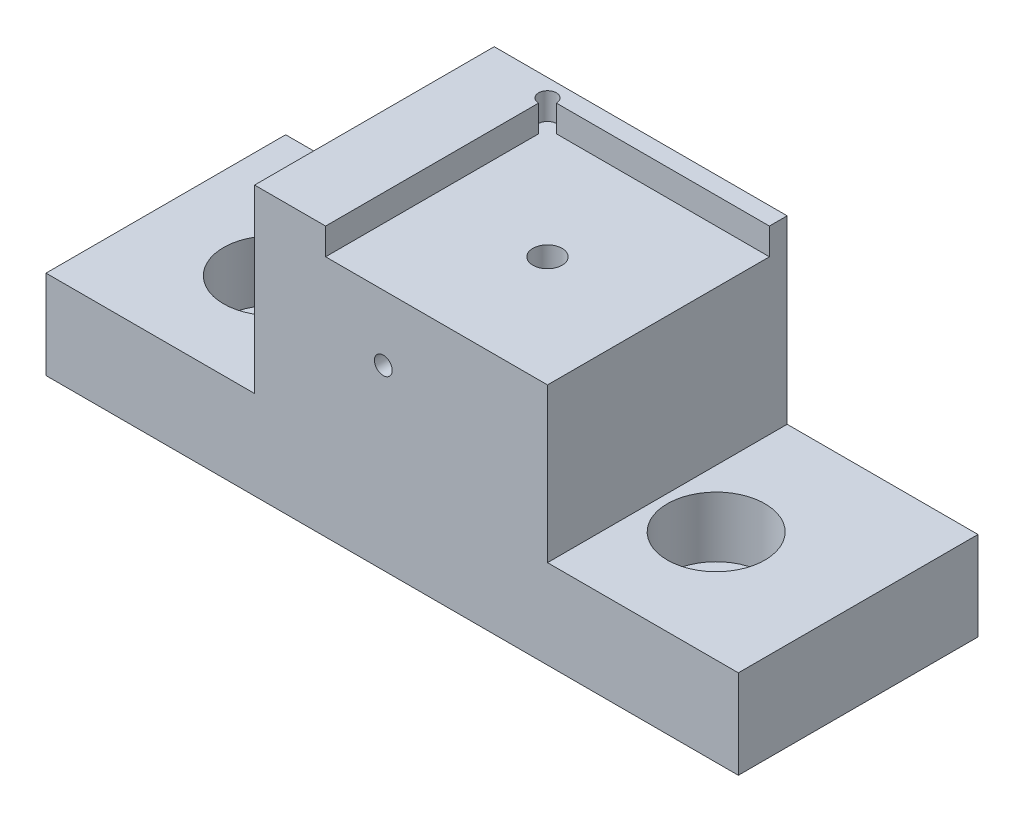
from build123d import *

# Parameters (mm, degrees)
SKETCH_1_W                = 29
SKETCH_1_H                = 29
EXTRUDE_1_DEPTH           = 5
SKETCH_2_W                = 25
SKETCH_2_H                = 25
CUT_EXTRUDE_1_DEPTH       = 3
SKETCH_3_W                = 35
SKETCH_3_H                = 29
EXTRUDE_748_DEPTH         = 25.341167732
HOLE_WIZARD_M4_1_D        = 3.3
HOLE_WIZARD_M4_1_DEPTH    = 10.1
HOLE_WIZARD_M4_1_TIP      = 0.991420021
SKETCH_9_R                = 1
CUT_EXTRUDE_2_DEPTH       = 3
SKETCH_11_W               = 29
SKETCH_11_H               = 5
EXTRUDE_4_DEPTH           = 6
CUT_EXTRUDE_8_DEPTH       = 40.383835
SKETCH_19_W               = 80
SKETCH_19_H               = 25
EXTRUDE_5_DEPTH           = 10
HOLE_WIZARD_1_D           = 6.6
HOLE_WIZARD_1_DEPTH       = 10.1
HOLE_WIZARD_1_CBORE_D     = 11
HOLE_WIZARD_1_CBORE_DEPTH = 6.8
HOLE_WIZARD_1_TIP         = 1.982840043
SKETCH_23_W               = 80
SKETCH_23_H               = 10
EXTRUDE_6_DEPTH           = 2
SKETCH_24_W               = 27
SKETCH_24_H               = 10
CUT_EXTRUDE_9_DEPTH       = 2
MM_1_D                    = 4
MM_1_DEPTH                = 5
MM_1_TIP                  = 1.201721238
CUT_EXTRUDE_10_DEPTH      = 5
SKETCH_28_R               = 1
CUT_EXTRUDE_11_DEPTH      = 2
HOLE_WIZARD_M6_1_D        = 5
HOLE_WIZARD_M6_1_DEPTH    = 10
HOLE_WIZARD_M6_1_TIP      = 1.502151548


with BuildPart() as part:
    # 草图1 → 凸台-拉伸1 (new body)
    with BuildSketch(Plane(origin=(0, 0, 0), x_dir=(1, 0, 0), z_dir=(0, 1, 0))):
        Rectangle(SKETCH_1_W, SKETCH_1_H)
    extrude(amount=EXTRUDE_1_DEPTH)

    # 草图2 → 切除-拉伸1 (cut)
    with BuildSketch(Plane.XZ.offset(-5)):
        Rectangle(SKETCH_2_W, SKETCH_2_H)
    extrude(amount=CUT_EXTRUDE_1_DEPTH, mode=Mode.SUBTRACT)

    # 草图3 → Extrude 748 (add)
    with BuildSketch(Plane(origin=(0, 0, 0), x_dir=(-1, 0, 0), z_dir=(0, -1, 0))):
        with Locations((3, 0)):
            Rectangle(SKETCH_3_W, SKETCH_3_H)
    extrude(amount=EXTRUDE_748_DEPTH)

    # M4 螺纹孔1
    with Locations(Plane.ZX.offset(2)):
        with Locations((0, 0)):
            Hole(HOLE_WIZARD_M4_1_D / 2, depth=HOLE_WIZARD_M4_1_DEPTH)
            with Locations((0, 0, -(HOLE_WIZARD_M4_1_DEPTH + HOLE_WIZARD_M4_1_TIP / 2))):  # 118° drill point
                Cone(0, HOLE_WIZARD_M4_1_D / 2, HOLE_WIZARD_M4_1_TIP, mode=Mode.SUBTRACT)

    # 草图9 → 切除-拉伸2 (cut)
    with BuildSketch(Plane(origin=(0, 5, 0), x_dir=(1, 0, 0), z_dir=(0, 1, 0))):
        with Locations((-12.5, 12.5)):
            Circle(SKETCH_9_R)
    extrude(amount=-CUT_EXTRUDE_2_DEPTH, mode=Mode.SUBTRACT)

    # 草图11 → 凸台-拉伸4 (add)
    with BuildSketch(Plane.ZY.offset(14.5)):
        with Locations((0, 2.5)):
            Rectangle(SKETCH_11_W, SKETCH_11_H)
    extrude(amount=EXTRUDE_4_DEPTH)

    # 草图17 → 切除-拉伸8 (cut, through all)
    with BuildSketch(Plane(origin=(0, 5, 0), x_dir=(1, 0, 0), z_dir=(0, 1, 0))):
        Polygon((-20.5, -14.5), (14.5, -14.5), (14.5, 14.5), (12.5, 14.5), (12.5, -12.5), (-20.5, -12.5), align=None)
    extrude(amount=-CUT_EXTRUDE_8_DEPTH, mode=Mode.SUBTRACT)

    # 草图19 → 凸台-拉伸5 (add)
    with BuildSketch(Plane(origin=(0, -25.341167732, 0), x_dir=(-1, 0, 0), z_dir=(0, -1, 0))):
        with Locations((6, 0)):
            Rectangle(SKETCH_19_W, SKETCH_19_H)
    extrude(amount=-EXTRUDE_5_DEPTH)

    # 打孔尺寸(%根据)内六角圆柱头螺钉的类型1
    with Locations(Plane(origin=(-31, -15.341167732, 0), x_dir=(0, 0, 1), z_dir=(0, 1, 0))):
        with Locations((0, 0), (0, 50)):
            CounterBoreHole(HOLE_WIZARD_1_D / 2, HOLE_WIZARD_1_CBORE_D / 2, HOLE_WIZARD_1_CBORE_DEPTH, depth=HOLE_WIZARD_1_DEPTH)
            with Locations((0, 0, -(HOLE_WIZARD_1_DEPTH + HOLE_WIZARD_1_TIP / 2))):  # 118° drill point
                Cone(0, HOLE_WIZARD_1_D / 2, HOLE_WIZARD_1_TIP, mode=Mode.SUBTRACT)

    # 草图23 → 凸台-拉伸6 (add)
    with BuildSketch(Plane(origin=(0, 0, -12.5), x_dir=(-1, 0, 0), z_dir=(0, 0, -1))):
        with Locations((6, -20.341167732)):
            Rectangle(SKETCH_23_W, SKETCH_23_H)
    extrude(amount=EXTRUDE_6_DEPTH)

    # 草图24 → 切除-拉伸9 (cut)
    with BuildSketch(Plane.ZY.offset(46)):
        with Locations((-1, -20.341167732)):
            Rectangle(SKETCH_24_W, SKETCH_24_H)
    extrude(amount=-CUT_EXTRUDE_9_DEPTH, mode=Mode.SUBTRACT)

    # 大小mm 暗销孔1
    with Locations(Plane(origin=(-16, -25.341167732, 0), x_dir=(0, 0, -1), z_dir=(0, -1, 0))):
        with Locations((0, 0)):
            Hole(MM_1_D / 2, depth=MM_1_DEPTH)
            with Locations((0, 0, -(MM_1_DEPTH + MM_1_TIP / 2))):  # 118° drill point
                Cone(0, MM_1_D / 2, MM_1_TIP, mode=Mode.SUBTRACT)

    # 草图27 → 切除-拉伸10 (cut)
    with BuildSketch(Plane.XZ.offset(25.341167732)):
        with BuildLine():
            Line((3.5, 2), (4.5, 2))
            ThreePointArc((4.5, 2), (6.5, 0), (4.5, -2))
            Line((4.5, -2), (3.5, -2))
            ThreePointArc((3.5, -2), (1.5, 0), (3.5, 2))
        make_face()
    extrude(amount=-CUT_EXTRUDE_10_DEPTH, mode=Mode.SUBTRACT)

    # 草图28 → 切除-拉伸11 (cut)
    with BuildSketch(Plane.XY.offset(12.5)):
        with Locations((-6, -5.341167732)):
            Circle(SKETCH_28_R)
    extrude(amount=-CUT_EXTRUDE_11_DEPTH, mode=Mode.SUBTRACT)

    # M6 螺纹孔1
    with Locations(Plane(origin=(-6, -25.341167732, 0), x_dir=(0, 0, -1), z_dir=(0, -1, 0))):
        with Locations((0, 0)):
            Hole(HOLE_WIZARD_M6_1_D / 2, depth=HOLE_WIZARD_M6_1_DEPTH)
            with Locations((0, 0, -(HOLE_WIZARD_M6_1_DEPTH + HOLE_WIZARD_M6_1_TIP / 2))):  # 118° drill point
                Cone(0, HOLE_WIZARD_M6_1_D / 2, HOLE_WIZARD_M6_1_TIP, mode=Mode.SUBTRACT)


solid = part.part
